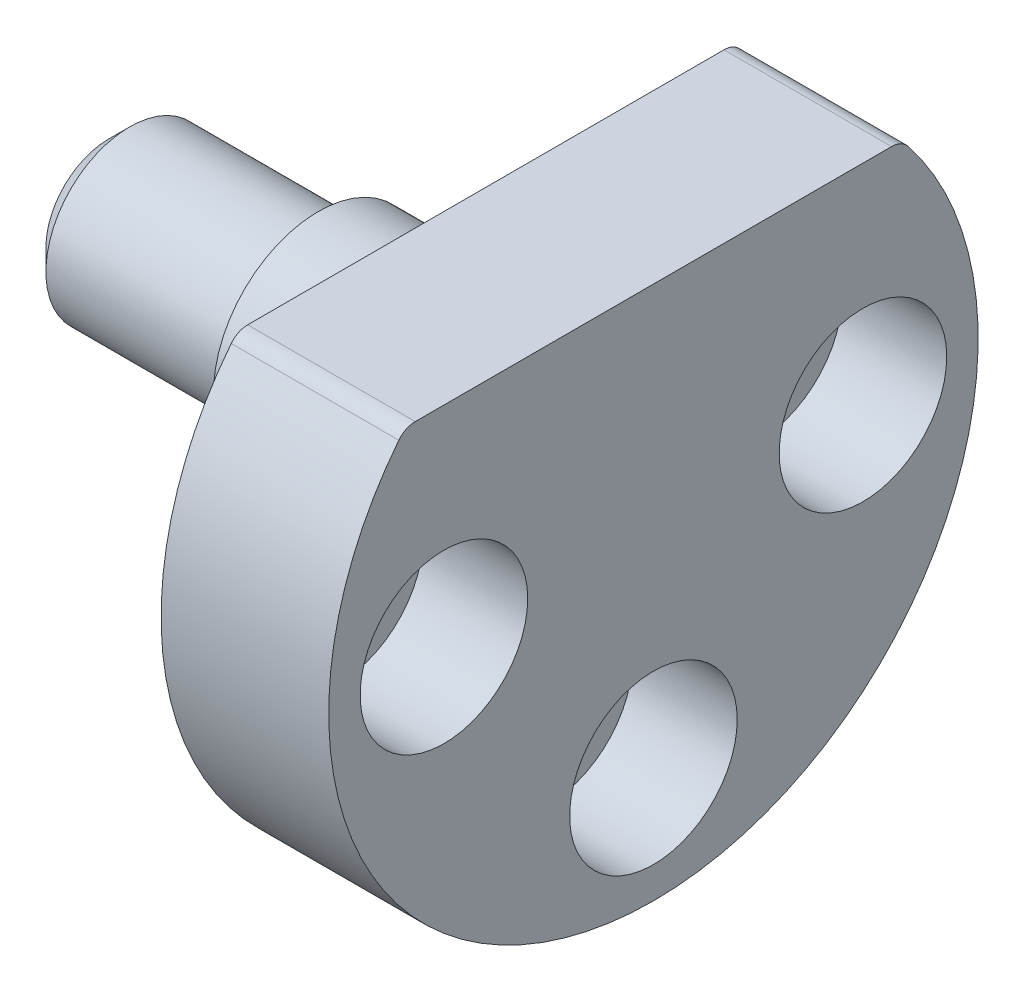
from build123d import *

# Parameters (mm, degrees)
BOSS_EXTRUDE1_DEPTH = 4
SKETCH1_3_R         = 1
CUT_EXTRUDE2_DEPTH  = 4
SKETCH1_4_R         = 2.5
BOSS_EXTRUDE2_DEPTH = 4
SKETCH1_5_R         = 2
BOSS_EXTRUDE3_DEPTH = 9
CHAMFER1_SIZE       = 0.5
FILLET1_R           = 0.5
SKETCH2_R           = 2
CUT_EXTRUDE3_DEPTH  = 2.5


with BuildPart() as part:
    # Sketch1 → Boss-Extrude1 (new body)
    with BuildSketch(Plane(origin=(0, 0, 0), x_dir=(0, 0, -1), z_dir=(1, 0, 0))):
        with BuildLine():
            Line((-5.921359641, 5), (5.921359641, 5))
            ThreePointArc((5.921359641, 5), (0, -7.75), (-5.921359641, 5))
        make_face()
    extrude(amount=BOSS_EXTRUDE1_DEPTH)

    # Sketch1<3> → Cut-Extrude2 (cut)
    with BuildSketch(Plane(origin=(0, 0, 0), x_dir=(0, 0, -1), z_dir=(1, 0, 0))):
        with Locations((-5, 0)):
            Circle(SKETCH1_3_R)
        with Locations((5, 0)):
            Circle(SKETCH1_3_R)
        with Locations((0, -5)):
            Circle(SKETCH1_3_R)
    extrude(amount=CUT_EXTRUDE2_DEPTH, mode=Mode.SUBTRACT)

    # Sketch1<4> → Boss-Extrude2 (add)
    with BuildSketch(Plane(origin=(0, 0, 0), x_dir=(0, 0, -1), z_dir=(1, 0, 0))):
        Circle(SKETCH1_4_R)
    extrude(amount=-BOSS_EXTRUDE2_DEPTH)

    # Sketch1<5> → Boss-Extrude3 (add)
    with BuildSketch(Plane(origin=(0, 0, 0), x_dir=(0, 0, -1), z_dir=(1, 0, 0))):
        Circle(SKETCH1_5_R)
    extrude(amount=-BOSS_EXTRUDE3_DEPTH)

    # Chamfer1
    chamfer1_edges = [part.edges().sort_by_distance(p)[0] for p in [
        (-9, 0, 2),
    ]]
    chamfer(chamfer1_edges, length=CHAMFER1_SIZE)

    # Fillet1
    fillet1_edges = [part.edges().sort_by_distance(p)[0] for p in [
        (2, 5, -5.921359641),
        (2, 5, 5.921359641),
    ]]
    fillet(fillet1_edges, radius=FILLET1_R)

    # Sketch2 → Cut-Extrude3 (cut)
    with BuildSketch(Plane(origin=(4, 0, 0), x_dir=(0, 0, -1), z_dir=(1, 0, 0))):
        with Locations((-5, 0)):
            Circle(SKETCH2_R)
        with Locations((5, 0)):
            Circle(SKETCH2_R)
        with Locations((0, -5)):
            Circle(SKETCH2_R)
    extrude(amount=-CUT_EXTRUDE3_DEPTH, mode=Mode.SUBTRACT)


solid = part.part
